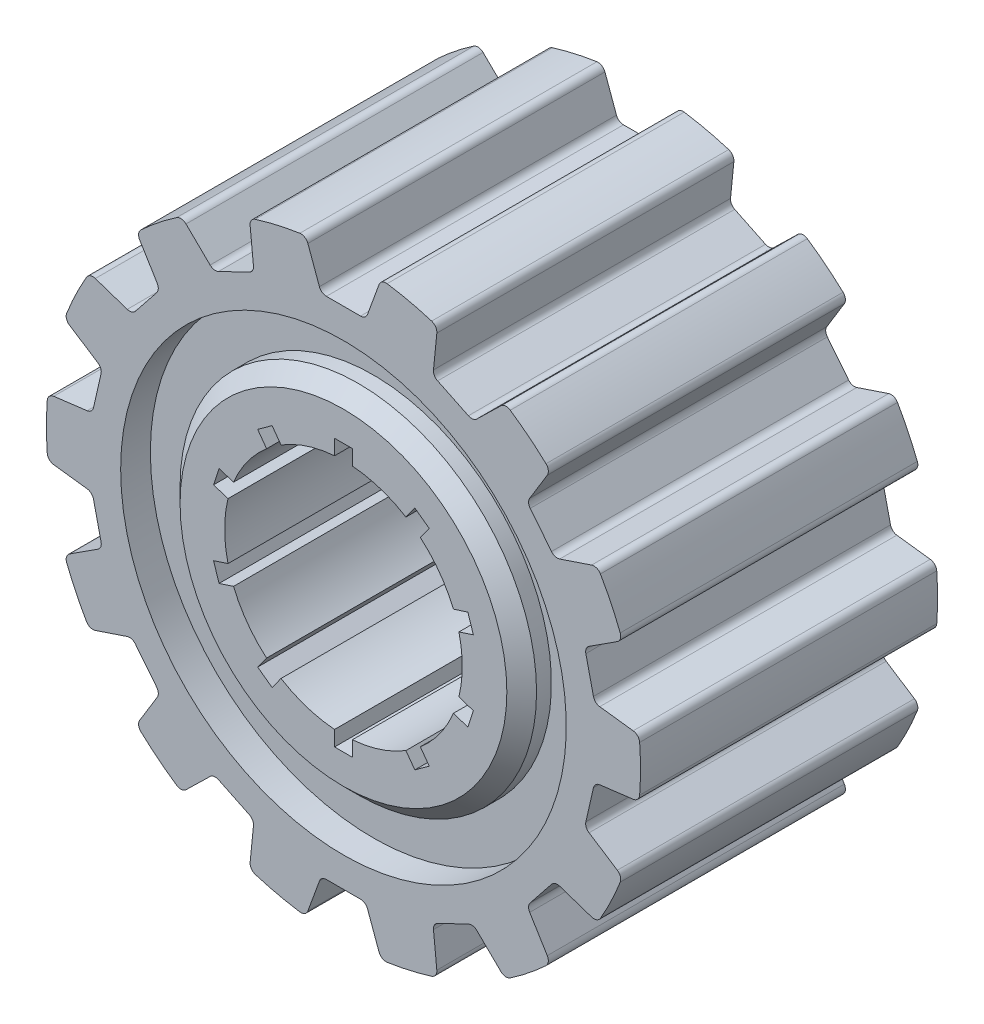
from build123d import *

# Parameters (mm, degrees)
SKETCH1_R           = 10
BOSS_EXTRUDE1_DEPTH = 10
CUT_EXTRUDE2_START  = -10
CUT_EXTRUDE2_DEPTH  = 28.320508076
CIRPATTERN1_COUNT   = 14
CUT_EXTRUDE8_START  = 4
SKETCH5_R           = 7.5
SKETCH5_R_2         = 6
CUT_EXTRUDE8_DEPTH  = 11.946425093
CHAMFER2_SIZE       = 0.5
CHAMFER3_SIZE       = 0.5
FILLET5_R           = 0.25


with BuildPart() as part:
    # Sketch1 → Boss-Extrude1 (new body)
    with BuildSketch(Plane.XY):
        Circle(SKETCH1_R)
        with BuildLine():
            Line((2.887738734, 3.464240899), (2.587224198, 3.050618126))
            ThreePointArc((2.587224198, 3.050618126), (3.236067977, 2.351141009), (3.700806493, 1.517903589))
            Line((3.700806493, 1.517903589), (4.187049225, 1.67589343))
            Line((4.187049225, 1.67589343), (4.372459422, 1.10525952))
            Line((4.372459422, 1.10525952), (3.886216689, 0.947269679))
            ThreePointArc((3.886216689, 0.947269679), (4, 0), (3.886216689, -0.947269679))
            Line((3.886216689, -0.947269679), (4.372459422, -1.10525952))
            Line((4.372459422, -1.10525952), (4.187049225, -1.67589343))
            Line((4.187049225, -1.67589343), (3.700806493, -1.517903589))
            ThreePointArc((3.700806493, -1.517903589), (3.236067977, -2.351141009), (2.587224198, -3.050618126))
            Line((2.587224198, -3.050618126), (2.887738734, -3.464240899))
            Line((2.887738734, -3.464240899), (2.402328537, -3.81691205))
            Line((2.402328537, -3.81691205), (2.101814002, -3.403289277))
            ThreePointArc((2.101814002, -3.403289277), (1.236067977, -3.804226065), (0.3, -3.988734135))
            Line((0.3, -3.988734135), (0.3, -4.5))
            Line((0.3, -4.5), (-0.3, -4.5))
            Line((-0.3, -4.5), (-0.3, -3.988734135))
            ThreePointArc((-0.3, -3.988734135), (-1.236067977, -3.804226065), (-2.101814002, -3.403289277))
            Line((-2.101814002, -3.403289277), (-2.402328537, -3.81691205))
            Line((-2.402328537, -3.81691205), (-2.887738734, -3.464240899))
            Line((-2.887738734, -3.464240899), (-2.587224198, -3.050618126))
            ThreePointArc((-2.587224198, -3.050618126), (-3.236067977, -2.351141009), (-3.700806493, -1.517903589))
            Line((-3.700806493, -1.517903589), (-4.187049225, -1.67589343))
            Line((-4.187049225, -1.67589343), (-4.372459422, -1.10525952))
            Line((-4.372459422, -1.10525952), (-3.886216689, -0.947269679))
            ThreePointArc((-3.886216689, -0.947269679), (-4, 0), (-3.886216689, 0.947269679))
            Line((-3.886216689, 0.947269679), (-4.372459422, 1.10525952))
            Line((-4.372459422, 1.10525952), (-4.187049225, 1.67589343))
            Line((-4.187049225, 1.67589343), (-3.700806493, 1.517903589))
            ThreePointArc((-3.700806493, 1.517903589), (-3.236067977, 2.351141009), (-2.587224198, 3.050618126))
            Line((-2.587224198, 3.050618126), (-2.887738734, 3.464240899))
            Line((-2.887738734, 3.464240899), (-2.402328537, 3.81691205))
            Line((-2.402328537, 3.81691205), (-2.101814002, 3.403289277))
            ThreePointArc((-2.101814002, 3.403289277), (-1.236067977, 3.804226065), (-0.3, 3.988734135))
            Line((-0.3, 3.988734135), (-0.3, 4.5))
            Line((-0.3, 4.5), (0.3, 4.5))
            Line((0.3, 4.5), (0.3, 3.988734135))
            ThreePointArc((0.3, 3.988734135), (1.236067977, 3.804226065), (2.101814002, 3.403289277))
            Line((2.101814002, 3.403289277), (2.402328537, 3.81691205))
            Line((2.402328537, 3.81691205), (2.887738734, 3.464240899))
        make_face(mode=Mode.SUBTRACT)
    extrude(amount=BOSS_EXTRUDE1_DEPTH)

    # Sketch2 → Cut-Extrude2 (cut)
    with BuildSketch(Plane.XY.offset(10).offset(CUT_EXTRUDE2_START)):
        Polygon((-20.341084154, 62.326061337), (-1.266640021, 9.919456792), (-0.75, 8.5), (0.75, 8.5), (1.266640021, 9.919456792), (20.341084154, 62.326061337), (20.341084154, 173.86594871), (-20.341084154, 173.86594871), align=None)
    cut_extrude2 = extrude(amount=CUT_EXTRUDE2_DEPTH, mode=Mode.SUBTRACT)

    # CirPattern1: Cut-Extrude2 ×14 about axis
    cirpattern1_axis = Axis((0, 0, 10), (0, 0, -1))
    for i in range(1, CIRPATTERN1_COUNT):
        add(cut_extrude2.rotate(cirpattern1_axis, i * 360 / CIRPATTERN1_COUNT), mode=Mode.SUBTRACT)

    # Sketch5 → Cut-Extrude8 (cut, through all)
    with BuildSketch(Plane(origin=(0, 0, 5), x_dir=(-1, 0, 0), z_dir=(0, 0, -1)).offset(CUT_EXTRUDE8_START)):
        Circle(SKETCH5_R)
        Circle(SKETCH5_R_2, mode=Mode.SUBTRACT)
    cut_extrude8 = extrude(amount=CUT_EXTRUDE8_DEPTH, mode=Mode.SUBTRACT)

    # Chamfer2
    chamfer2_edges = [part.edges().sort_by_distance(p)[0] for p in [
        (6, 0, 0),
    ]]
    chamfer(chamfer2_edges, length=CHAMFER2_SIZE)

    # Mirror4: Cut-Extrude8 across plane
    add(cut_extrude8.mirror(Plane(origin=(0, 0, 5), x_dir=(1, 0, 0), z_dir=(0, 0, -1))), mode=Mode.SUBTRACT)

    # Chamfer3
    chamfer3_edges = [part.edges().sort_by_distance(p)[0] for p in [
        (6, 0, 10),
    ]]
    chamfer(chamfer3_edges, length=CHAMFER3_SIZE)

    # Fillet5
    fillet5_edges = [part.edges().sort_by_distance(p)[0] for p in [
        (-1.266640021, 9.919456792, 5),
        (-0.75, 8.5, 5),
        (0.75, 8.5, 5),
        (1.266640021, 9.919456792, 5),
        (3.162687777, 9.486696265, 5),
        (3.012285132, 7.983648182, 5),
        (4.363738433, 7.332822573, 5),
        (5.445094229, 8.387547248, 5),
        (6.965606473, 7.174979196, 5),
        (6.17795025, 5.886036928, 5),
        (7.113184952, 4.713289704, 5),
        (8.545080745, 5.194381104, 5),
        (9.38890138, 3.442169501, 5),
        (8.119996553, 2.622623873, 5),
        (8.453777954, 1.160232004, 5),
        (9.952609221, 0.972404078, 5),
        (9.952609221, -0.972404078, 5),
        (8.453777954, -1.160232004, 5),
        (8.119996553, -2.622623873, 5),
        (9.38890138, -3.442169501, 5),
        (8.545080745, -5.194381104, 5),
        (7.113184952, -4.713289704, 5),
        (6.17795025, -5.886036928, 5),
        (6.965606473, -7.174979196, 5),
        (5.445094229, -8.387547248, 5),
        (4.363738433, -7.332822573, 5),
        (3.012285132, -7.983648182, 5),
        (3.162687777, -9.486696265, 5),
        (1.266640021, -9.919456792, 5),
        (0.75, -8.5, 5),
        (-0.75, -8.5, 5),
        (-1.266640021, -9.919456792, 5),
        (-3.162687777, -9.486696265, 5),
        (-3.012285132, -7.983648182, 5),
        (-4.363738433, -7.332822573, 5),
        (-5.445094229, -8.387547248, 5),
        (-6.965606473, -7.174979196, 5),
        (-6.17795025, -5.886036928, 5),
        (-7.113184952, -4.713289704, 5),
        (-8.545080745, -5.194381104, 5),
        (-9.38890138, -3.442169501, 5),
        (-8.119996553, -2.622623873, 5),
        (-8.453777954, -1.160232004, 5),
        (-9.952609221, -0.972404078, 5),
        (-9.952609221, 0.972404078, 5),
        (-8.453777954, 1.160232004, 5),
        (-8.119996553, 2.622623873, 5),
        (-9.38890138, 3.442169501, 5),
        (-8.545080745, 5.194381104, 5),
        (-7.113184952, 4.713289704, 5),
        (-6.17795025, 5.886036928, 5),
        (-6.965606473, 7.174979196, 5),
        (-5.445094229, 8.387547248, 5),
        (-4.363738433, 7.332822573, 5),
        (-3.012285132, 7.983648182, 5),
        (-3.162687777, 9.486696265, 5),
    ]]
    fillet(fillet5_edges, radius=FILLET5_R)


solid = part.part
